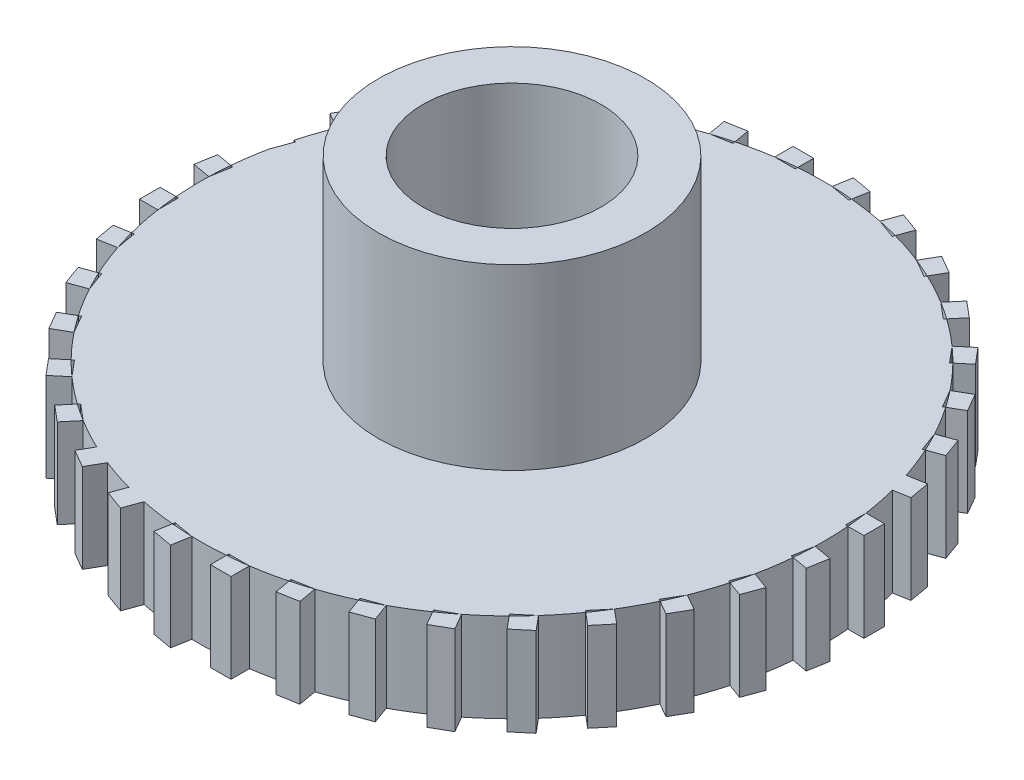
from build123d import *

# Parameters (mm, degrees)
BOSS_EXTRUDE1_DEPTH    = 6.35
SKETCH1_R              = 6.35
BOSS_EXTRUDE1_2_DEPTH  = 6.35
BOSS_EXTRUDE1_3_DEPTH  = 6.35
BOSS_EXTRUDE1_4_DEPTH  = 6.35
BOSS_EXTRUDE1_5_DEPTH  = 6.35
BOSS_EXTRUDE1_6_DEPTH  = 6.35
BOSS_EXTRUDE1_7_DEPTH  = 6.35
BOSS_EXTRUDE1_8_DEPTH  = 6.35
BOSS_EXTRUDE1_9_DEPTH  = 6.35
BOSS_EXTRUDE1_10_DEPTH = 6.35
BOSS_EXTRUDE1_11_DEPTH = 6.35
BOSS_EXTRUDE1_12_DEPTH = 6.35
BOSS_EXTRUDE1_13_DEPTH = 6.35
BOSS_EXTRUDE1_14_DEPTH = 6.35
BOSS_EXTRUDE1_15_DEPTH = 6.35
BOSS_EXTRUDE1_16_DEPTH = 6.35
BOSS_EXTRUDE1_17_DEPTH = 6.35
BOSS_EXTRUDE1_18_DEPTH = 6.35
BOSS_EXTRUDE1_19_DEPTH = 6.35
BOSS_EXTRUDE1_20_DEPTH = 6.35
BOSS_EXTRUDE1_21_DEPTH = 6.35
BOSS_EXTRUDE1_22_DEPTH = 6.35
BOSS_EXTRUDE1_23_DEPTH = 6.35
BOSS_EXTRUDE1_24_DEPTH = 6.35
BOSS_EXTRUDE1_25_DEPTH = 6.35
BOSS_EXTRUDE1_26_DEPTH = 6.35
BOSS_EXTRUDE1_27_DEPTH = 6.35
BOSS_EXTRUDE1_28_DEPTH = 6.35
BOSS_EXTRUDE1_29_DEPTH = 6.35
BOSS_EXTRUDE1_30_DEPTH = 6.35
BOSS_EXTRUDE1_31_DEPTH = 6.35
BOSS_EXTRUDE1_32_DEPTH = 6.35
BOSS_EXTRUDE1_33_DEPTH = 6.35
SKETCH2_R              = 9.525
SKETCH2_R_2            = 6.35
BOSS_EXTRUDE2_DEPTH    = 12.7


with BuildPart() as part:
    # Sketch1 → Boss-Extrude1 (new body)
    with BuildSketch(Plane(origin=(0, 0, 0), x_dir=(1, 0, 0), z_dir=(0, 1, 0))):
        with BuildLine():
            Line((-23.509277211, 0.83426937), (-22.216726922, 0.60635788))
            ThreePointArc((-22.216726922, 0.60635788), (-22.184303152, 1.344365518), (-22.127370617, 2.080887929))
            Line((-22.127370617, 2.080887929), (-23.254423299, 2.279617725))
            Line((-23.254423299, 2.279617725), (-23.509277211, 0.83426937))
        make_face()
    extrude(amount=BOSS_EXTRUDE1_DEPTH)


with BuildPart() as body_2:
    # Sketch1 → Boss-Extrude1 2 (new body)
    with BuildSketch(Plane(origin=(0, 0, 0), x_dir=(1, 0, 0), z_dir=(0, 1, 0))):
        with BuildLine():
            Line((-21.96187301, 2.051706235), (-22.216726922, 0.60635788))
            ThreePointArc((-22.216726922, 0.60635788), (-22.217054356, -0.594239617), (-22.152548534, -1.793103019))
            Line((-22.152548534, -1.793103019), (-21.98449786, -1.793103019))
            Line((-21.98449786, -1.793103019), (-21.98449786, -3.260748202))
            ThreePointArc((-21.98449786, -3.260748202), (-21.776338753, -4.443162784), (-21.504632474, -5.612611439))
            Line((-21.504632474, -5.612611439), (-21.339134867, -5.583429745))
            Line((-21.339134867, -5.583429745), (-21.084280956, -7.028778101))
            ThreePointArc((-21.084280956, -7.028778101), (-20.673960115, -8.157082698), (-20.203309038, -9.2615835))
            Line((-20.203309038, -9.2615835), (-20.045393059, -9.204106784))
            Line((-20.045393059, -9.204106784), (-19.543428843, -10.583242133))
            ThreePointArc((-19.543428843, -10.583242133), (-18.943413661, -11.623153783), (-18.28811828, -12.629147033))
            Line((-18.28811828, -12.629147033), (-18.142582127, -12.545121696))
            Line((-18.142582127, -12.545121696), (-17.408759535, -13.816139709))
            ThreePointArc((-17.408759535, -13.816139709), (-16.637281169, -14.736061221), (-15.817252302, -15.612980324))
            Line((-15.817252302, -15.612980324), (-15.688518017, -15.504959433))
            Line((-15.688518017, -15.504959433), (-14.745133878, -16.62924087))
            ThreePointArc((-14.745133878, -16.62924087), (-13.825633307, -17.401220895), (-12.865787117, -18.122421109))
            Line((-12.865787117, -18.122421109), (-12.757766226, -17.993686824))
            Line((-12.757766226, -17.993686824), (-11.633484789, -18.937070963))
            ThreePointArc((-11.633484789, -18.937070963), (-10.593900574, -19.537653279), (-9.523401501, -20.081221299))
            Line((-9.523401501, -20.081221299), (-10.095621144, -21.072334794))
            Line((-10.095621144, -21.072334794), (-8.824603132, -21.806157386))
            Line((-8.824603132, -21.806157386), (-8.168358152, -20.669507737))
            ThreePointArc((-8.168358152, -20.669507737), (-7.040277532, -21.080443953), (-5.891652149, -21.429863741))
            Line((-5.891652149, -21.429863741), (-6.283073438, -22.505284893))
            Line((-6.283073438, -22.505284893), (-4.90393809, -23.007249109))
            Line((-4.90393809, -23.007249109), (-4.455040085, -21.773911978))
            ThreePointArc((-4.455040085, -21.773911978), (-3.27273922, -21.982716006), (-2.080887929, -22.127370617))
            Line((-2.080887929, -22.127370617), (-2.051706235, -21.96187301))
            Line((-2.051706235, -21.96187301), (-0.60635788, -22.216726922))
            ThreePointArc((-0.60635788, -22.216726922), (0.594239617, -22.217054356), (1.793103019, -22.152548534))
            Line((1.793103019, -22.152548534), (1.793103019, -21.98449786))
            Line((1.793103019, -21.98449786), (3.260748202, -21.98449786))
            ThreePointArc((3.260748202, -21.98449786), (4.443162784, -21.776338753), (5.612611439, -21.504632474))
            Line((5.612611439, -21.504632474), (5.583429745, -21.339134867))
            Line((5.583429745, -21.339134867), (7.028778101, -21.084280956))
            ThreePointArc((7.028778101, -21.084280956), (8.157082698, -20.673960115), (9.2615835, -20.203309038))
            Line((9.2615835, -20.203309038), (9.204106784, -20.045393059))
            Line((9.204106784, -20.045393059), (10.583242133, -19.543428843))
            ThreePointArc((10.583242133, -19.543428843), (11.623153783, -18.943413661), (12.629147033, -18.28811828))
            Line((12.629147033, -18.28811828), (12.545121696, -18.142582127))
            Line((12.545121696, -18.142582127), (13.816139709, -17.408759535))
            ThreePointArc((13.816139709, -17.408759535), (14.736061221, -16.637281169), (15.612980324, -15.817252302))
            Line((15.612980324, -15.817252302), (15.504959433, -15.688518017))
            Line((15.504959433, -15.688518017), (16.62924087, -14.745133878))
            ThreePointArc((16.62924087, -14.745133878), (17.401220895, -13.825633307), (18.122421109, -12.865787117))
            Line((18.122421109, -12.865787117), (17.993686824, -12.757766226))
            Line((17.993686824, -12.757766226), (18.937070963, -11.633484789))
            ThreePointArc((18.937070963, -11.633484789), (19.537653279, -10.593900574), (20.081221299, -9.523401501))
            Line((20.081221299, -9.523401501), (19.935685146, -9.439376164))
            Line((19.935685146, -9.439376164), (20.669507737, -8.168358152))
            ThreePointArc((20.669507737, -8.168358152), (21.080443953, -7.040277532), (21.429863741, -5.891652149))
            Line((21.429863741, -5.891652149), (21.271947762, -5.834175434))
            Line((21.271947762, -5.834175434), (21.773911978, -4.455040085))
            ThreePointArc((21.773911978, -4.455040085), (21.982716006, -3.27273922), (22.127370617, -2.080887929))
            Line((22.127370617, -2.080887929), (21.96187301, -2.051706235))
            Line((21.96187301, -2.051706235), (22.216726922, -0.60635788))
            ThreePointArc((22.216726922, -0.60635788), (22.217054356, 0.594239617), (22.152548534, 1.793103019))
            Line((22.152548534, 1.793103019), (21.98449786, 1.793103019))
            Line((21.98449786, 1.793103019), (21.98449786, 3.260748202))
            ThreePointArc((21.98449786, 3.260748202), (21.776338753, 4.443162784), (21.504632474, 5.612611439))
            Line((21.504632474, 5.612611439), (22.631685156, 5.811341235))
            Line((22.631685156, 5.811341235), (22.376831245, 7.25668959))
            Line((22.376831245, 7.25668959), (21.084280956, 7.028778101))
            ThreePointArc((21.084280956, 7.028778101), (20.673960115, 8.157082698), (20.203309038, 9.2615835))
            Line((20.203309038, 9.2615835), (20.045393059, 9.204106784))
            Line((20.045393059, 9.204106784), (19.543428843, 10.583242133))
            ThreePointArc((19.543428843, 10.583242133), (18.943413661, 11.623153783), (18.28811828, 12.629147033))
            Line((18.28811828, 12.629147033), (18.142582127, 12.545121696))
            Line((18.142582127, 12.545121696), (17.408759535, 13.816139709))
            ThreePointArc((17.408759535, 13.816139709), (16.637281169, 14.736061221), (15.817252302, 15.612980324))
            Line((15.817252302, 15.612980324), (15.688518017, 15.504959433))
            Line((15.688518017, 15.504959433), (14.745133878, 16.62924087))
            ThreePointArc((14.745133878, 16.62924087), (13.825633307, 17.401220895), (12.865787117, 18.122421109))
            Line((12.865787117, 18.122421109), (12.757766226, 17.993686824))
            Line((12.757766226, 17.993686824), (11.633484789, 18.937070963))
            ThreePointArc((11.633484789, 18.937070963), (10.593900574, 19.537653279), (9.523401501, 20.081221299))
            Line((9.523401501, 20.081221299), (9.439376164, 19.935685146))
            Line((9.439376164, 19.935685146), (8.168358152, 20.669507737))
            ThreePointArc((8.168358152, 20.669507737), (7.040277532, 21.080443953), (5.891652149, 21.429863741))
            Line((5.891652149, 21.429863741), (5.834175434, 21.271947762))
            Line((5.834175434, 21.271947762), (4.455040085, 21.773911978))
            ThreePointArc((4.455040085, 21.773911978), (3.27273922, 21.982716006), (2.080887929, 22.127370617))
            Line((2.080887929, 22.127370617), (2.051706235, 21.96187301))
            Line((2.051706235, 21.96187301), (0.60635788, 22.216726922))
            ThreePointArc((0.60635788, 22.216726922), (-0.594239617, 22.217054356), (-1.793103019, 22.152548534))
            Line((-1.793103019, 22.152548534), (-1.793103019, 21.98449786))
            Line((-1.793103019, 21.98449786), (-3.260748202, 21.98449786))
            ThreePointArc((-3.260748202, 21.98449786), (-4.443162784, 21.776338753), (-5.612611439, 21.504632474))
            Line((-5.612611439, 21.504632474), (-5.583429745, 21.339134867))
            Line((-5.583429745, 21.339134867), (-7.028778101, 21.084280956))
            ThreePointArc((-7.028778101, 21.084280956), (-8.157082698, 20.673960115), (-9.2615835, 20.203309038))
            Line((-9.2615835, 20.203309038), (-9.204106784, 20.045393059))
            Line((-9.204106784, 20.045393059), (-10.583242133, 19.543428843))
            ThreePointArc((-10.583242133, 19.543428843), (-11.623153783, 18.943413661), (-12.629147033, 18.28811828))
            Line((-12.629147033, 18.28811828), (-12.545121696, 18.142582127))
            Line((-12.545121696, 18.142582127), (-13.816139709, 17.408759535))
            ThreePointArc((-13.816139709, 17.408759535), (-14.736061221, 16.637281169), (-15.612980324, 15.817252302))
            Line((-15.612980324, 15.817252302), (-15.504959433, 15.688518017))
            Line((-15.504959433, 15.688518017), (-16.62924087, 14.745133878))
            ThreePointArc((-16.62924087, 14.745133878), (-17.401220895, 13.825633307), (-18.122421109, 12.865787117))
            Line((-18.122421109, 12.865787117), (-17.993686824, 12.757766226))
            Line((-17.993686824, 12.757766226), (-18.937070963, 11.633484789))
            ThreePointArc((-18.937070963, 11.633484789), (-19.537653279, 10.593900574), (-20.081221299, 9.523401501))
            Line((-20.081221299, 9.523401501), (-19.935685146, 9.439376164))
            Line((-19.935685146, 9.439376164), (-20.669507737, 8.168358152))
            ThreePointArc((-20.669507737, 8.168358152), (-21.080443953, 7.040277532), (-21.429863741, 5.891652149))
            Line((-21.429863741, 5.891652149), (-21.271947762, 5.834175434))
            Line((-21.271947762, 5.834175434), (-21.773911978, 4.455040085))
            ThreePointArc((-21.773911978, 4.455040085), (-21.982716006, 3.27273922), (-22.127370617, 2.080887929))
            Line((-22.127370617, 2.080887929), (-21.96187301, 2.051706235))
        make_face()
        with Locations(Location((0, 0, 0), (0, 0, 270))):
            Circle(SKETCH1_R, mode=Mode.SUBTRACT)
    extrude(amount=BOSS_EXTRUDE1_2_DEPTH)

    # Sketch2 → Boss-Extrude2 (add)
    with BuildSketch(Plane(origin=(0, 6.35, 0), x_dir=(1, 0, 0), z_dir=(0, 1, 0))):
        with Locations(Location((0, 0, 0), (0, 0, 270))):
            Circle(SKETCH2_R)
        with Locations(Location((0, 0, 0), (0, 0, 270))):
            Circle(SKETCH2_R_2, mode=Mode.SUBTRACT)
    extrude(amount=BOSS_EXTRUDE2_DEPTH)


with BuildPart() as body_3:
    # Sketch1 → Boss-Extrude1 3 (new body)
    with BuildSketch(Plane(origin=(0, 0, 0), x_dir=(1, 0, 0), z_dir=(0, 1, 0))):
        with BuildLine():
            ThreePointArc((-21.98449786, -3.260748202), (-22.080720362, -2.52832223), (-22.152548534, -1.793103019))
            Line((-22.152548534, -1.793103019), (-23.296987821, -1.793103019))
            Line((-23.296987821, -1.793103019), (-23.296987821, -3.260748202))
            Line((-23.296987821, -3.260748202), (-21.98449786, -3.260748202))
        make_face()
    extrude(amount=BOSS_EXTRUDE1_3_DEPTH)


with BuildPart() as body_4:
    # Sketch1 → Boss-Extrude1 4 (new body)
    with BuildSketch(Plane(origin=(0, 0, 0), x_dir=(1, 0, 0), z_dir=(0, 1, 0))):
        with BuildLine():
            ThreePointArc((-21.084280956, -7.028778101), (-21.306226057, -6.324188187), (-21.504632474, -5.612611439))
            Line((-21.504632474, -5.612611439), (-22.631685156, -5.811341235))
            Line((-22.631685156, -5.811341235), (-22.376831245, -7.25668959))
            Line((-22.376831245, -7.25668959), (-21.084280956, -7.028778101))
        make_face()
    extrude(amount=BOSS_EXTRUDE1_4_DEPTH)


with BuildPart() as body_5:
    # Sketch1 → Boss-Extrude1 5 (new body)
    with BuildSketch(Plane(origin=(0, 0, 0), x_dir=(1, 0, 0), z_dir=(0, 1, 0))):
        with BuildLine():
            Line((-21.806157386, 8.824603132), (-20.669507737, 8.168358152))
            ThreePointArc((-20.669507737, 8.168358152), (-20.386625882, 8.850768901), (-20.081221299, 9.523401501))
            Line((-20.081221299, 9.523401501), (-21.072334794, 10.095621144))
            Line((-21.072334794, 10.095621144), (-21.806157386, 8.824603132))
        make_face()
    extrude(amount=BOSS_EXTRUDE1_5_DEPTH)


with BuildPart() as body_6:
    # Sketch1 → Boss-Extrude1 6 (new body)
    with BuildSketch(Plane(origin=(0, 0, 0), x_dir=(1, 0, 0), z_dir=(0, 1, 0))):
        with BuildLine():
            ThreePointArc((-19.543428843, -10.583242133), (-19.884352854, -9.927896885), (-20.203309038, -9.2615835))
            Line((-20.203309038, -9.2615835), (-21.27873019, -9.653004789))
            Line((-21.27873019, -9.653004789), (-20.776765974, -11.032140137))
            Line((-20.776765974, -11.032140137), (-19.543428843, -10.583242133))
        make_face()
    extrude(amount=BOSS_EXTRUDE1_6_DEPTH)


with BuildPart() as body_7:
    # Sketch1 → Boss-Extrude1 7 (new body)
    with BuildSketch(Plane(origin=(0, 0, 0), x_dir=(1, 0, 0), z_dir=(0, 1, 0))):
        with BuildLine():
            Line((-19.942496604, 12.477137073), (-18.937070963, 11.633484789))
            ThreePointArc((-18.937070963, 11.633484789), (-18.539987336, 12.256406267), (-18.122421109, 12.865787117))
            Line((-18.122421109, 12.865787117), (-18.999112465, 13.601418511))
            Line((-18.999112465, 13.601418511), (-19.942496604, 12.477137073))
        make_face()
    extrude(amount=BOSS_EXTRUDE1_7_DEPTH)


with BuildPart() as body_8:
    # Sketch1 → Boss-Extrude1 8 (new body)
    with BuildSketch(Plane(origin=(0, 0, 0), x_dir=(1, 0, 0), z_dir=(0, 1, 0))):
        with BuildLine():
            ThreePointArc((-17.408759535, -13.816139709), (-17.858303652, -13.229951461), (-18.28811828, -12.629147033))
            Line((-18.28811828, -12.629147033), (-19.279231775, -13.201366676))
            Line((-19.279231775, -13.201366676), (-18.545409183, -14.472384689))
            Line((-18.545409183, -14.472384689), (-17.408759535, -13.816139709))
        make_face()
    extrude(amount=BOSS_EXTRUDE1_8_DEPTH)


with BuildPart() as body_9:
    # Sketch1 → Boss-Extrude1 9 (new body)
    with BuildSketch(Plane(origin=(0, 0, 0), x_dir=(1, 0, 0), z_dir=(0, 1, 0))):
        with BuildLine():
            Line((-17.472893155, 15.750559519), (-16.62924087, 14.745133878))
            ThreePointArc((-16.62924087, 14.745133878), (-16.130020656, 15.289638931), (-15.612980324, 15.817252302))
            Line((-15.612980324, 15.817252302), (-16.348611718, 16.693943658))
            Line((-16.348611718, 16.693943658), (-17.472893155, 15.750559519))
        make_face()
    extrude(amount=BOSS_EXTRUDE1_9_DEPTH)


with BuildPart() as body_10:
    # Sketch1 → Boss-Extrude1 10 (new body)
    with BuildSketch(Plane(origin=(0, 0, 0), x_dir=(1, 0, 0), z_dir=(0, 1, 0))):
        with BuildLine():
            ThreePointArc((-14.745133878, -16.62924087), (-15.289638931, -16.130020656), (-15.817252302, -15.612980324))
            Line((-15.817252302, -15.612980324), (-16.693943658, -16.348611718))
            Line((-16.693943658, -16.348611718), (-15.750559519, -17.472893155))
            Line((-15.750559519, -17.472893155), (-14.745133878, -16.62924087))
        make_face()
    extrude(amount=BOSS_EXTRUDE1_10_DEPTH)


with BuildPart() as body_11:
    # Sketch1 → Boss-Extrude1 11 (new body)
    with BuildSketch(Plane(origin=(0, 0, 0), x_dir=(1, 0, 0), z_dir=(0, 1, 0))):
        with BuildLine():
            Line((-14.472384689, 18.545409183), (-13.816139709, 17.408759535))
            ThreePointArc((-13.816139709, 17.408759535), (-13.229951461, 17.858303652), (-12.629147033, 18.28811828))
            Line((-12.629147033, 18.28811828), (-13.201366676, 19.279231775))
            Line((-13.201366676, 19.279231775), (-14.472384689, 18.545409183))
        make_face()
    extrude(amount=BOSS_EXTRUDE1_11_DEPTH)


with BuildPart() as body_12:
    # Sketch1 → Boss-Extrude1 12 (new body)
    with BuildSketch(Plane(origin=(0, 0, 0), x_dir=(1, 0, 0), z_dir=(0, 1, 0))):
        with BuildLine():
            ThreePointArc((-11.633484789, -18.937070963), (-12.256406267, -18.539987336), (-12.865787117, -18.122421109))
            Line((-12.865787117, -18.122421109), (-13.601418511, -18.999112465))
            Line((-13.601418511, -18.999112465), (-12.477137073, -19.942496604))
            Line((-12.477137073, -19.942496604), (-11.633484789, -18.937070963))
        make_face()
    extrude(amount=BOSS_EXTRUDE1_12_DEPTH)


with BuildPart() as body_13:
    # Sketch1 → Boss-Extrude1 13 (new body)
    with BuildSketch(Plane(origin=(0, 0, 0), x_dir=(1, 0, 0), z_dir=(0, 1, 0))):
        with BuildLine():
            Line((-11.032140137, 20.776765974), (-10.583242133, 19.543428843))
            ThreePointArc((-10.583242133, 19.543428843), (-9.927896885, 19.884352854), (-9.2615835, 20.203309038))
            Line((-9.2615835, 20.203309038), (-9.653004789, 21.27873019))
            Line((-9.653004789, 21.27873019), (-11.032140137, 20.776765974))
        make_face()
    extrude(amount=BOSS_EXTRUDE1_13_DEPTH)


with BuildPart() as body_14:
    # Sketch1 → Boss-Extrude1 14 (new body)
    with BuildSketch(Plane(origin=(0, 0, 0), x_dir=(1, 0, 0), z_dir=(0, 1, 0))):
        with BuildLine():
            Line((-7.25668959, 22.376831245), (-7.028778101, 21.084280956))
            ThreePointArc((-7.028778101, 21.084280956), (-6.324188187, 21.306226057), (-5.612611439, 21.504632474))
            Line((-5.612611439, 21.504632474), (-5.811341235, 22.631685156))
            Line((-5.811341235, 22.631685156), (-7.25668959, 22.376831245))
        make_face()
    extrude(amount=BOSS_EXTRUDE1_14_DEPTH)


with BuildPart() as body_15:
    # Sketch1 → Boss-Extrude1 15 (new body)
    with BuildSketch(Plane(origin=(0, 0, 0), x_dir=(1, 0, 0), z_dir=(0, 1, 0))):
        with BuildLine():
            Line((-3.260748202, 23.296987821), (-3.260748202, 21.98449786))
            ThreePointArc((-3.260748202, 21.98449786), (-2.52832223, 22.080720362), (-1.793103019, 22.152548534))
            Line((-1.793103019, 22.152548534), (-1.793103019, 23.296987821))
            Line((-1.793103019, 23.296987821), (-3.260748202, 23.296987821))
        make_face()
    extrude(amount=BOSS_EXTRUDE1_15_DEPTH)


with BuildPart() as body_16:
    # Sketch1 → Boss-Extrude1 16 (new body)
    with BuildSketch(Plane(origin=(0, 0, 0), x_dir=(1, 0, 0), z_dir=(0, 1, 0))):
        with BuildLine():
            ThreePointArc((-0.60635788, -22.216726922), (-1.344365518, -22.184303152), (-2.080887929, -22.127370617))
            Line((-2.080887929, -22.127370617), (-2.279617725, -23.254423299))
            Line((-2.279617725, -23.254423299), (-0.83426937, -23.509277211))
            Line((-0.83426937, -23.509277211), (-0.60635788, -22.216726922))
        make_face()
    extrude(amount=BOSS_EXTRUDE1_16_DEPTH)


with BuildPart() as body_17:
    # Sketch1 → Boss-Extrude1 17 (new body)
    with BuildSketch(Plane(origin=(0, 0, 0), x_dir=(1, 0, 0), z_dir=(0, 1, 0))):
        with BuildLine():
            Line((0.83426937, 23.509277211), (0.60635788, 22.216726922))
            ThreePointArc((0.60635788, 22.216726922), (1.344365518, 22.184303152), (2.080887929, 22.127370617))
            Line((2.080887929, 22.127370617), (2.279617725, 23.254423299))
            Line((2.279617725, 23.254423299), (0.83426937, 23.509277211))
        make_face()
    extrude(amount=BOSS_EXTRUDE1_17_DEPTH)


with BuildPart() as body_18:
    # Sketch1 → Boss-Extrude1 18 (new body)
    with BuildSketch(Plane(origin=(0, 0, 0), x_dir=(1, 0, 0), z_dir=(0, 1, 0))):
        with BuildLine():
            ThreePointArc((3.260748202, -21.98449786), (2.52832223, -22.080720362), (1.793103019, -22.152548534))
            Line((1.793103019, -22.152548534), (1.793103019, -23.296987821))
            Line((1.793103019, -23.296987821), (3.260748202, -23.296987821))
            Line((3.260748202, -23.296987821), (3.260748202, -21.98449786))
        make_face()
    extrude(amount=BOSS_EXTRUDE1_18_DEPTH)


with BuildPart() as body_19:
    # Sketch1 → Boss-Extrude1 19 (new body)
    with BuildSketch(Plane(origin=(0, 0, 0), x_dir=(1, 0, 0), z_dir=(0, 1, 0))):
        with BuildLine():
            Line((4.90393809, 23.007249109), (4.455040085, 21.773911978))
            ThreePointArc((4.455040085, 21.773911978), (5.1762054, 21.613827117), (5.891652149, 21.429863741))
            Line((5.891652149, 21.429863741), (6.283073438, 22.505284893))
            Line((6.283073438, 22.505284893), (4.90393809, 23.007249109))
        make_face()
    extrude(amount=BOSS_EXTRUDE1_19_DEPTH)


with BuildPart() as body_20:
    # Sketch1 → Boss-Extrude1 20 (new body)
    with BuildSketch(Plane(origin=(0, 0, 0), x_dir=(1, 0, 0), z_dir=(0, 1, 0))):
        with BuildLine():
            ThreePointArc((7.028778101, -21.084280956), (6.324188187, -21.306226057), (5.612611439, -21.504632474))
            Line((5.612611439, -21.504632474), (5.811341235, -22.631685156))
            Line((5.811341235, -22.631685156), (7.25668959, -22.376831245))
            Line((7.25668959, -22.376831245), (7.028778101, -21.084280956))
        make_face()
    extrude(amount=BOSS_EXTRUDE1_20_DEPTH)


with BuildPart() as body_21:
    # Sketch1 → Boss-Extrude1 21 (new body)
    with BuildSketch(Plane(origin=(0, 0, 0), x_dir=(1, 0, 0), z_dir=(0, 1, 0))):
        with BuildLine():
            Line((8.824603132, 21.806157386), (8.168358152, 20.669507737))
            ThreePointArc((8.168358152, 20.669507737), (8.850768901, 20.386625882), (9.523401501, 20.081221299))
            Line((9.523401501, 20.081221299), (10.095621144, 21.072334794))
            Line((10.095621144, 21.072334794), (8.824603132, 21.806157386))
        make_face()
    extrude(amount=BOSS_EXTRUDE1_21_DEPTH)


with BuildPart() as body_22:
    # Sketch1 → Boss-Extrude1 22 (new body)
    with BuildSketch(Plane(origin=(0, 0, 0), x_dir=(1, 0, 0), z_dir=(0, 1, 0))):
        with BuildLine():
            ThreePointArc((10.583242133, -19.543428843), (9.927896885, -19.884352854), (9.2615835, -20.203309038))
            Line((9.2615835, -20.203309038), (9.653004789, -21.27873019))
            Line((9.653004789, -21.27873019), (11.032140137, -20.776765974))
            Line((11.032140137, -20.776765974), (10.583242133, -19.543428843))
        make_face()
    extrude(amount=BOSS_EXTRUDE1_22_DEPTH)


with BuildPart() as body_23:
    # Sketch1 → Boss-Extrude1 23 (new body)
    with BuildSketch(Plane(origin=(0, 0, 0), x_dir=(1, 0, 0), z_dir=(0, 1, 0))):
        with BuildLine():
            Line((12.477137073, 19.942496604), (11.633484789, 18.937070963))
            ThreePointArc((11.633484789, 18.937070963), (12.256406267, 18.539987336), (12.865787117, 18.122421109))
            Line((12.865787117, 18.122421109), (13.601418511, 18.999112465))
            Line((13.601418511, 18.999112465), (12.477137073, 19.942496604))
        make_face()
    extrude(amount=BOSS_EXTRUDE1_23_DEPTH)


with BuildPart() as body_24:
    # Sketch1 → Boss-Extrude1 24 (new body)
    with BuildSketch(Plane(origin=(0, 0, 0), x_dir=(1, 0, 0), z_dir=(0, 1, 0))):
        with BuildLine():
            ThreePointArc((13.816139709, -17.408759535), (13.229951461, -17.858303652), (12.629147033, -18.28811828))
            Line((12.629147033, -18.28811828), (13.201366676, -19.279231775))
            Line((13.201366676, -19.279231775), (14.472384689, -18.545409183))
            Line((14.472384689, -18.545409183), (13.816139709, -17.408759535))
        make_face()
    extrude(amount=BOSS_EXTRUDE1_24_DEPTH)


with BuildPart() as body_25:
    # Sketch1 → Boss-Extrude1 25 (new body)
    with BuildSketch(Plane(origin=(0, 0, 0), x_dir=(1, 0, 0), z_dir=(0, 1, 0))):
        with BuildLine():
            Line((15.750559519, 17.472893155), (14.745133878, 16.62924087))
            ThreePointArc((14.745133878, 16.62924087), (15.289638931, 16.130020656), (15.817252302, 15.612980324))
            Line((15.817252302, 15.612980324), (16.693943658, 16.348611718))
            Line((16.693943658, 16.348611718), (15.750559519, 17.472893155))
        make_face()
    extrude(amount=BOSS_EXTRUDE1_25_DEPTH)


with BuildPart() as body_26:
    # Sketch1 → Boss-Extrude1 26 (new body)
    with BuildSketch(Plane(origin=(0, 0, 0), x_dir=(1, 0, 0), z_dir=(0, 1, 0))):
        with BuildLine():
            ThreePointArc((16.62924087, -14.745133878), (16.130020656, -15.289638931), (15.612980324, -15.817252302))
            Line((15.612980324, -15.817252302), (16.348611718, -16.693943658))
            Line((16.348611718, -16.693943658), (17.472893155, -15.750559519))
            Line((17.472893155, -15.750559519), (16.62924087, -14.745133878))
        make_face()
    extrude(amount=BOSS_EXTRUDE1_26_DEPTH)


with BuildPart() as body_27:
    # Sketch1 → Boss-Extrude1 27 (new body)
    with BuildSketch(Plane(origin=(0, 0, 0), x_dir=(1, 0, 0), z_dir=(0, 1, 0))):
        with BuildLine():
            Line((18.545409183, 14.472384689), (17.408759535, 13.816139709))
            ThreePointArc((17.408759535, 13.816139709), (17.858303652, 13.229951461), (18.28811828, 12.629147033))
            Line((18.28811828, 12.629147033), (19.279231775, 13.201366676))
            Line((19.279231775, 13.201366676), (18.545409183, 14.472384689))
        make_face()
    extrude(amount=BOSS_EXTRUDE1_27_DEPTH)


with BuildPart() as body_28:
    # Sketch1 → Boss-Extrude1 28 (new body)
    with BuildSketch(Plane(origin=(0, 0, 0), x_dir=(1, 0, 0), z_dir=(0, 1, 0))):
        with BuildLine():
            ThreePointArc((18.937070963, -11.633484789), (18.539987336, -12.256406267), (18.122421109, -12.865787117))
            Line((18.122421109, -12.865787117), (18.999112465, -13.601418511))
            Line((18.999112465, -13.601418511), (19.942496604, -12.477137073))
            Line((19.942496604, -12.477137073), (18.937070963, -11.633484789))
        make_face()
    extrude(amount=BOSS_EXTRUDE1_28_DEPTH)


with BuildPart() as body_29:
    # Sketch1 → Boss-Extrude1 29 (new body)
    with BuildSketch(Plane(origin=(0, 0, 0), x_dir=(1, 0, 0), z_dir=(0, 1, 0))):
        with BuildLine():
            Line((20.776765974, 11.032140137), (19.543428843, 10.583242133))
            ThreePointArc((19.543428843, 10.583242133), (19.884352854, 9.927896885), (20.203309038, 9.2615835))
            Line((20.203309038, 9.2615835), (21.27873019, 9.653004789))
            Line((21.27873019, 9.653004789), (20.776765974, 11.032140137))
        make_face()
    extrude(amount=BOSS_EXTRUDE1_29_DEPTH)


with BuildPart() as body_30:
    # Sketch1 → Boss-Extrude1 30 (new body)
    with BuildSketch(Plane(origin=(0, 0, 0), x_dir=(1, 0, 0), z_dir=(0, 1, 0))):
        with BuildLine():
            ThreePointArc((20.669507737, -8.168358152), (20.386625882, -8.850768901), (20.081221299, -9.523401501))
            Line((20.081221299, -9.523401501), (21.072334794, -10.095621144))
            Line((21.072334794, -10.095621144), (21.806157386, -8.824603132))
            Line((21.806157386, -8.824603132), (20.669507737, -8.168358152))
        make_face()
    extrude(amount=BOSS_EXTRUDE1_30_DEPTH)


with BuildPart() as body_31:
    # Sketch1 → Boss-Extrude1 31 (new body)
    with BuildSketch(Plane(origin=(0, 0, 0), x_dir=(1, 0, 0), z_dir=(0, 1, 0))):
        with BuildLine():
            ThreePointArc((21.773911978, -4.455040085), (21.613827117, -5.1762054), (21.429863741, -5.891652149))
            Line((21.429863741, -5.891652149), (22.505284893, -6.283073438))
            Line((22.505284893, -6.283073438), (23.007249109, -4.90393809))
            Line((23.007249109, -4.90393809), (21.773911978, -4.455040085))
        make_face()
    extrude(amount=BOSS_EXTRUDE1_31_DEPTH)


with BuildPart() as body_32:
    # Sketch1 → Boss-Extrude1 32 (new body)
    with BuildSketch(Plane(origin=(0, 0, 0), x_dir=(1, 0, 0), z_dir=(0, 1, 0))):
        with BuildLine():
            Line((23.296987821, 3.260748202), (21.98449786, 3.260748202))
            ThreePointArc((21.98449786, 3.260748202), (22.080720362, 2.52832223), (22.152548534, 1.793103019))
            Line((22.152548534, 1.793103019), (23.296987821, 1.793103019))
            Line((23.296987821, 1.793103019), (23.296987821, 3.260748202))
        make_face()
    extrude(amount=BOSS_EXTRUDE1_32_DEPTH)


with BuildPart() as body_33:
    # Sketch1 → Boss-Extrude1 33 (new body)
    with BuildSketch(Plane(origin=(0, 0, 0), x_dir=(1, 0, 0), z_dir=(0, 1, 0))):
        with BuildLine():
            ThreePointArc((22.216726922, -0.60635788), (22.184303152, -1.344365518), (22.127370617, -2.080887929))
            Line((22.127370617, -2.080887929), (23.254423299, -2.279617725))
            Line((23.254423299, -2.279617725), (23.509277211, -0.83426937))
            Line((23.509277211, -0.83426937), (22.216726922, -0.60635788))
        make_face()
    extrude(amount=BOSS_EXTRUDE1_33_DEPTH)


solid = Compound([part.part, body_2.part, body_3.part, body_4.part, body_5.part, body_6.part, body_7.part, body_8.part, body_9.part, body_10.part, body_11.part, body_12.part, body_13.part, body_14.part, body_15.part, body_16.part, body_17.part, body_18.part, body_19.part, body_20.part, body_21.part, body_22.part, body_23.part, body_24.part, body_25.part, body_26.part, body_27.part, body_28.part, body_29.part, body_30.part, body_31.part, body_32.part, body_33.part])
